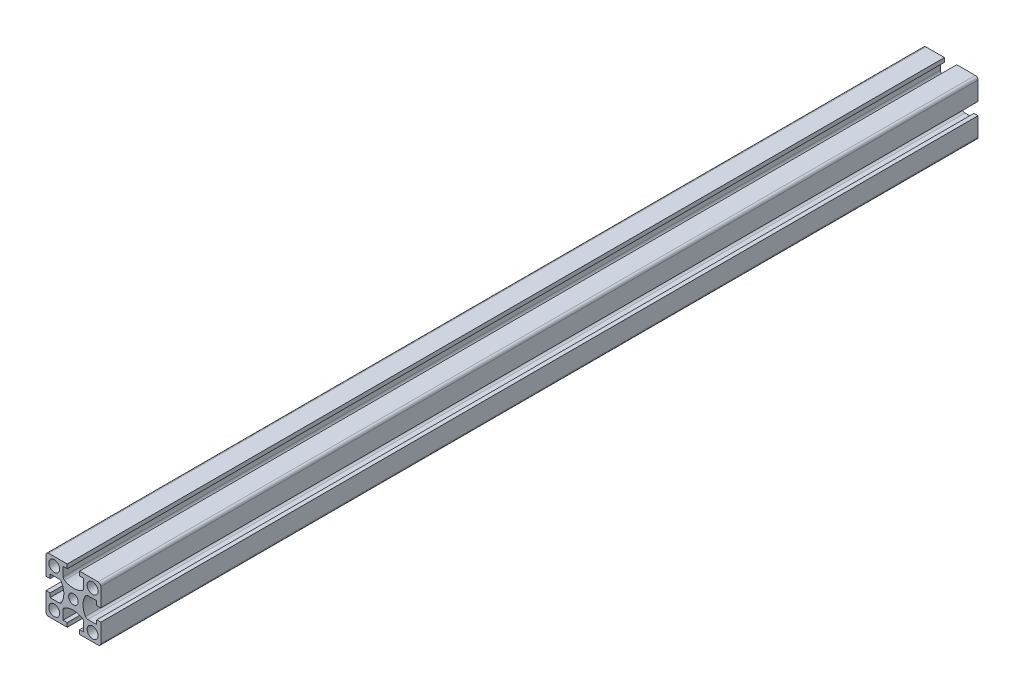
from build123d import *

# Parameters (mm, degrees)
SKETCH1_R           = 2.5
SKETCH1_R_2         = 2.1875
BOSS_EXTRUDE1_DEPTH = 400


with BuildPart() as part:
    # Sketch1 → Boss-Extrude1 (new body)
    with BuildSketch(Plane.XY):
        with BuildLine():
            Line((-12.5, 11.25), (-12.5, 2.8125))
            Line((-12.5, 2.8125), (-10.625, 2.8125))
            Line((-10.625, 2.8125), (-10.625, 4.6875))
            Line((-10.625, 4.6875), (-6.546075349, 4.6875))
            ThreePointArc((-6.546075349, 4.6875), (-5.921075349, 4.520031755), (-5.463543594, 4.0625))
            ThreePointArc((-5.463543594, 4.0625), (-4.375, 0), (-5.463543594, -4.0625))
            ThreePointArc((-5.463543594, -4.0625), (-5.921075349, -4.520031755), (-6.546075349, -4.6875))
            Line((-6.546075349, -4.6875), (-10.625, -4.6875))
            Line((-10.625, -4.6875), (-10.625, -2.8125))
            Line((-10.625, -2.8125), (-12.5, -2.8125))
            Line((-12.5, -2.8125), (-12.5, -11.25))
            ThreePointArc((-12.5, -11.25), (-12.133883476, -12.133883476), (-11.25, -12.5))
            Line((-11.25, -12.5), (-2.8125, -12.5))
            Line((-2.8125, -12.5), (-2.8125, -10.625))
            Line((-2.8125, -10.625), (-4.6875, -10.625))
            Line((-4.6875, -10.625), (-4.6875, -6.546075349))
            ThreePointArc((-4.6875, -6.546075349), (-4.520031755, -5.921075349), (-4.0625, -5.463543594))
            ThreePointArc((-4.0625, -5.463543594), (0, -4.375), (4.0625, -5.463543594))
            ThreePointArc((4.0625, -5.463543594), (4.520031755, -5.921075349), (4.6875, -6.546075349))
            Line((4.6875, -6.546075349), (4.6875, -10.625))
            Line((4.6875, -10.625), (2.8125, -10.625))
            Line((2.8125, -10.625), (2.8125, -12.5))
            Line((2.8125, -12.5), (11.25, -12.5))
            ThreePointArc((11.25, -12.5), (12.133883476, -12.133883476), (12.5, -11.25))
            Line((12.5, -11.25), (12.5, -2.8125))
            Line((12.5, -2.8125), (10.625, -2.8125))
            Line((10.625, -2.8125), (10.625, -4.6875))
            Line((10.625, -4.6875), (6.546075349, -4.6875))
            ThreePointArc((6.546075349, -4.6875), (5.921075349, -4.520031755), (5.463543594, -4.0625))
            ThreePointArc((5.463543594, -4.0625), (4.375, 0), (5.463543594, 4.0625))
            ThreePointArc((5.463543594, 4.0625), (5.921075349, 4.520031755), (6.546075349, 4.6875))
            Line((6.546075349, 4.6875), (10.625, 4.6875))
            Line((10.625, 4.6875), (10.625, 2.8125))
            Line((10.625, 2.8125), (12.5, 2.8125))
            Line((12.5, 2.8125), (12.5, 11.25))
            ThreePointArc((12.5, 11.25), (12.133883476, 12.133883476), (11.25, 12.5))
            Line((11.25, 12.5), (2.8125, 12.5))
            Line((2.8125, 12.5), (2.8125, 10.625))
            Line((2.8125, 10.625), (4.6875, 10.625))
            Line((4.6875, 10.625), (4.6875, 6.546075349))
            ThreePointArc((4.6875, 6.546075349), (4.520031755, 5.921075349), (4.0625, 5.463543594))
            ThreePointArc((4.0625, 5.463543594), (0, 4.375), (-4.0625, 5.463543594))
            ThreePointArc((-4.0625, 5.463543594), (-4.520031755, 5.921075349), (-4.6875, 6.546075349))
            Line((-4.6875, 6.546075349), (-4.6875, 10.625))
            Line((-4.6875, 10.625), (-2.8125, 10.625))
            Line((-2.8125, 10.625), (-2.8125, 12.5))
            Line((-2.8125, 12.5), (-11.25, 12.5))
            ThreePointArc((-11.25, 12.5), (-12.133883476, 12.133883476), (-12.5, 11.25))
        make_face()
        with Locations((-8.75, -8.75)):
            Circle(SKETCH1_R, mode=Mode.SUBTRACT)
        with Locations((8.75, -8.75)):
            Circle(SKETCH1_R, mode=Mode.SUBTRACT)
        with Locations((8.75, 8.75)):
            Circle(SKETCH1_R, mode=Mode.SUBTRACT)
        Circle(SKETCH1_R_2, mode=Mode.SUBTRACT)
        with Locations((-8.75, 8.75)):
            Circle(SKETCH1_R, mode=Mode.SUBTRACT)
    extrude(amount=BOSS_EXTRUDE1_DEPTH)


solid = part.part
